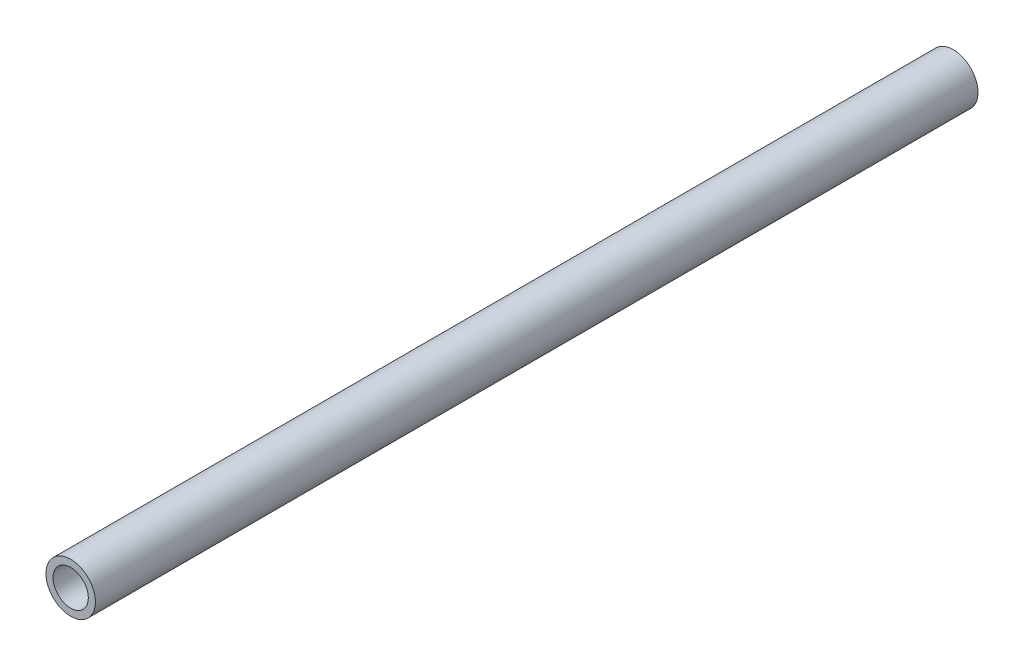
from build123d import *

# Parameters (mm, degrees)
SKETCH_1_R      = 7
SKETCH_1_R_2    = 5
EXTRUDE_1_DEPTH = 250


with BuildPart() as part:
    # 스케치1 → 보스-돌출1 (new body)
    with BuildSketch(Plane.XY):
        Circle(SKETCH_1_R)
        Circle(SKETCH_1_R_2, mode=Mode.SUBTRACT)
    extrude(amount=EXTRUDE_1_DEPTH)


solid = part.part
